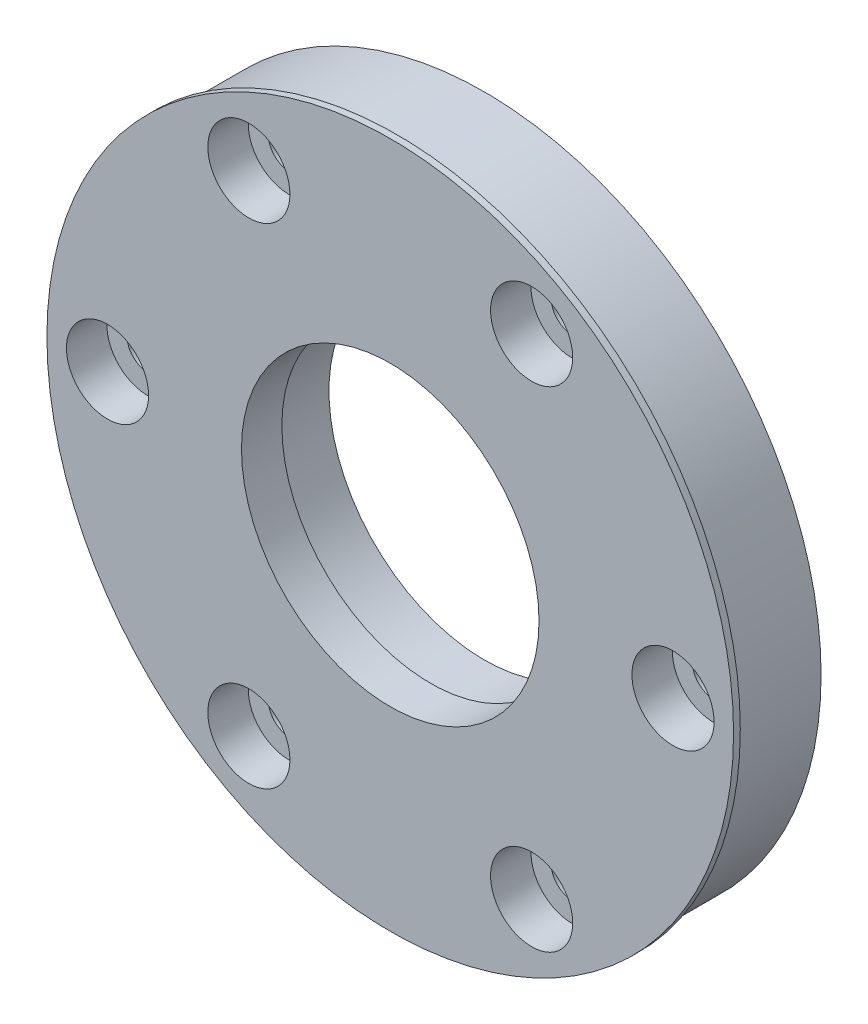
from build123d import *

# Parameters (mm, degrees)
SKETCH2_R                           = 25
BOSS_EXTRUDE1_DEPTH                 = 7
SKETCH3_R                           = 3.05
DOWEL_PIN_CUTOUT_DEPTH              = 3
MAIN_START                          = -0.5
SKETCH4_R                           = 25.5
SKETCH4_R_2                         = 25
MAIN_HOUSING_BEARING_RETAINER_DEPTH = 0.5
SKETCH5_R                           = 1.55
M3_THRU_DEPTH                       = 37.735541373
SKETCH6_R                           = 3
M3_BUTTON_HEAD_CUTOUT_DEPTH         = 1.7
SKETCH8_R                           = 11.55
INPUT_SHAFT_BEARING_CUTOUT_DEPTH    = 37.735541373
INPUT_START                         = -7
SKETCH9_R                           = 11.55
SKETCH9_R_2                         = 11.05
INPUT_SHAFT_BEARING_RETAINER_DEPTH  = 3


with BuildPart() as part:
    # Sketch2 → Boss-Extrude1 (new body)
    with BuildSketch(Plane.XY):
        Circle(SKETCH2_R)
    extrude(amount=BOSS_EXTRUDE1_DEPTH)

    # Sketch3 → Dowel Pin Cutout (cut)
    with BuildSketch(Plane.XY.offset(7)):
        with Locations((-21, 0)):
            Circle(SKETCH3_R)
        with Locations((-10.5, 18.186533479)):
            Circle(SKETCH3_R)
        with Locations((10.5, 18.186533479)):
            Circle(SKETCH3_R)
        with Locations((21, 0)):
            Circle(SKETCH3_R)
        with Locations((10.5, -18.186533479)):
            Circle(SKETCH3_R)
        with Locations((-10.5, -18.186533479)):
            Circle(SKETCH3_R)
    extrude(amount=-DOWEL_PIN_CUTOUT_DEPTH, mode=Mode.SUBTRACT)

    # Sketch4 → Main Housing Bearing Retainer (add)
    with BuildSketch(Plane.XY.offset(7).offset(MAIN_START)):
        Circle(SKETCH4_R)
        Circle(SKETCH4_R_2, mode=Mode.SUBTRACT)
    extrude(amount=MAIN_HOUSING_BEARING_RETAINER_DEPTH)

    # Sketch5 → M3 Thru (cut, through all)
    with BuildSketch(Plane(origin=(0, 0, 0), x_dir=(-1, 0, 0), z_dir=(0, 0, -1))):
        with Locations((-21, 0)):
            Circle(SKETCH5_R)
        with Locations((-10.5, 18.186533479)):
            Circle(SKETCH5_R)
        with Locations((10.5, 18.186533479)):
            Circle(SKETCH5_R)
        with Locations((21, 0)):
            Circle(SKETCH5_R)
        with Locations((10.5, -18.186533479)):
            Circle(SKETCH5_R)
        with Locations((-10.5, -18.186533479)):
            Circle(SKETCH5_R)
    extrude(amount=-M3_THRU_DEPTH, mode=Mode.SUBTRACT)

    # Sketch6 → M3 Button Head Cutout (cut)
    with BuildSketch(Plane(origin=(0, 0, 0), x_dir=(-1, 0, 0), z_dir=(0, 0, -1))):
        with Locations((-21, 0)):
            Circle(SKETCH6_R)
        with Locations((-10.5, 18.186533479)):
            Circle(SKETCH6_R)
        with Locations((10.5, 18.186533479)):
            Circle(SKETCH6_R)
        with Locations((21, 0)):
            Circle(SKETCH6_R)
        with Locations((10.5, -18.186533479)):
            Circle(SKETCH6_R)
        with Locations((-10.5, -18.186533479)):
            Circle(SKETCH6_R)
    extrude(amount=-M3_BUTTON_HEAD_CUTOUT_DEPTH, mode=Mode.SUBTRACT)

    # Sketch8 → Input Shaft Bearing Cutout (cut, through all)
    with BuildSketch(Plane.XY.offset(7)):
        Circle(SKETCH8_R)
    extrude(amount=-INPUT_SHAFT_BEARING_CUTOUT_DEPTH, mode=Mode.SUBTRACT)

    # Sketch9 → Input Shaft Bearing Retainer (add)
    with BuildSketch(Plane(origin=(0, 0, 0), x_dir=(-1, 0, 0), z_dir=(0, 0, -1)).offset(INPUT_START)):
        with Locations(Location((0, 0, 0), (0, 0, 180))):
            Circle(SKETCH9_R)
        with Locations(Location((0, 0, 0), (0, 0, 180))):
            Circle(SKETCH9_R_2, mode=Mode.SUBTRACT)
    extrude(amount=INPUT_SHAFT_BEARING_RETAINER_DEPTH)


solid = part.part
